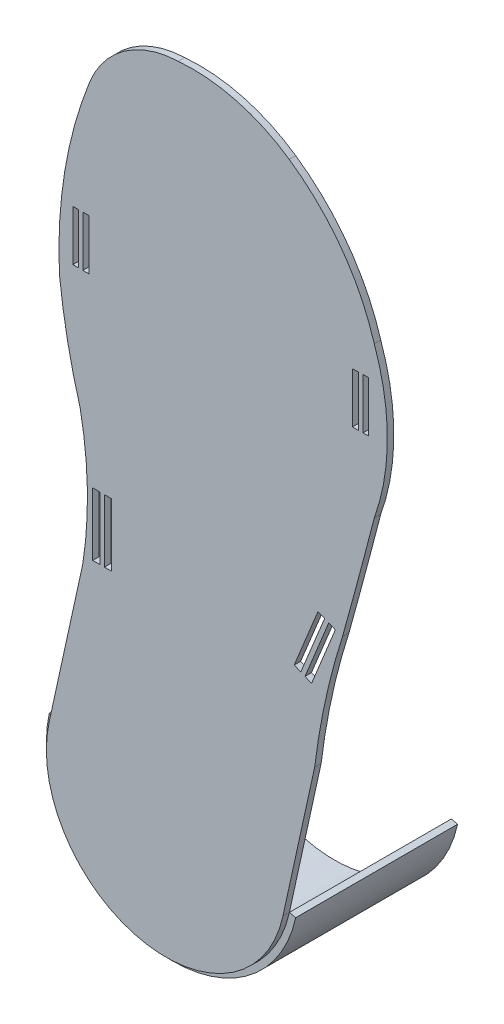
from build123d import *

# Parameters (mm, degrees)
BOSS_EXTRUDE1_DEPTH = 10
BOSS_EXTRUDE2_DEPTH = 250
SKETCH3_W           = 9.565213244
SKETCH3_H           = 77.966410476
SKETCH3_W_2         = 8.353543979
SKETCH3_H_2         = 77.966410475
CUT_EXTRUDE1_DEPTH  = 250
SKETCH4_W           = 11
SKETCH4_H           = 97
CUT_EXTRUDE2_DEPTH  = 250


with BuildPart() as part:
    # Sketch1 → Boss-Extrude1 (new body)
    with BuildSketch(Plane.XY):
        with BuildLine():
            Line((-51.984126252, 392.74957316), (0, 630.098149599))
            ThreePointArc((0, 630.098149599), (7.08288491, 733.363548715), (-3.984096645, 836.278231013))
            ThreePointArc((-3.984096645, 836.278231013), (-23.520457502, 916.694909006), (-36.012597338, 998.502353272))
            ThreePointArc((-36.012597338, 998.502353272), (-27.83897086, 1141.608720593), (10.535208392, 1279.716153066))
            ThreePointArc((10.535208392, 1279.716153066), (64.625002116, 1348.250843062), (147.435292888, 1375.912463775))
            ThreePointArc((147.435292888, 1375.912463775), (237.109169245, 1368.171524242), (318.838797646, 1330.467491469))
            ThreePointArc((318.838797646, 1330.467491469), (399.875156257, 1251.203752857), (450.033178317, 1149.548430819))
            ThreePointArc((450.033178317, 1149.548430819), (470.234397487, 1033.122029824), (450.033178317, 916.695628829))
            ThreePointArc((450.033178317, 916.695628829), (425.902967507, 824.914102712), (400.908098576, 733.364268538))
            ThreePointArc((400.908098576, 733.364268538), (374.881556851, 636.564375255), (358.063754215, 537.74756632))
            Line((358.063754215, 537.74756632), (308.99038073, 313.688874225))
            ThreePointArc((308.99038073, 313.688874225), (88.972777771, 172.731970202), (-51.984126252, 392.74957316))
        make_face()
    extrude(amount=BOSS_EXTRUDE1_DEPTH)

    # Sketch3 → Cut-Extrude1 (cut)
    with BuildSketch(Plane(origin=(0, 0, 0), x_dir=(-1, 0, 0), z_dir=(0, 0, -1))):
        with Locations((-4.782606622, 1061.735695438)):
            Rectangle(SKETCH3_W, SKETCH3_H)
        with Locations((11.17677199, 1061.735695438)):
            Rectangle(SKETCH3_W_2, SKETCH3_H)
        with Locations((-437.019311557, 1060.877248381)):
            Rectangle(SKETCH3_W_2, SKETCH3_H_2)
        with Locations((-421.059932945, 1060.448024852)):
            Rectangle(SKETCH3_W, SKETCH3_H_2)
    extrude(amount=-CUT_EXTRUDE1_DEPTH, mode=Mode.SUBTRACT)

    # Sketch4 → Cut-Extrude2 (cut)
    with BuildSketch(Plane(origin=(0, 0, 0), x_dir=(-1, 0, 0), z_dir=(0, 0, -1))):
        with Locations((-38.83297081, 691.059824561)):
            Rectangle(SKETCH4_W, SKETCH4_H)
        with Locations((-20.83297081, 691.059824561)):
            Rectangle(SKETCH4_W, SKETCH4_H)
        Polygon((-363.124216695, 747.966415693), (-326.394029606, 658.189506878), (-336.574916173, 654.024227929), (-373.305103262, 743.801136745), align=None)
        Polygon((-389.952232486, 736.954664741), (-353.222045397, 647.177755926), (-343.041158831, 651.343034874), (-379.77134592, 741.119943689), align=None)
    extrude(amount=-CUT_EXTRUDE2_DEPTH, mode=Mode.SUBTRACT)


with BuildPart() as body_2:
    # Sketch2 → Boss-Extrude2 (new body)
    with BuildSketch(Plane(origin=(0, 0, 0), x_dir=(-1, 0, 0), z_dir=(0, 0, -1))):
        with BuildLine():
            Line((-318.758829625, 311.549386859), (-308.99038073, 313.688874225))
            ThreePointArc((-308.99038073, 313.688874225), (-88.972777771, 172.731970202), (51.984126252, 392.74957316))
            Line((51.984126252, 392.74957316), (61.752575147, 394.889060526))
            ThreePointArc((61.752575147, 394.889060526), (-86.833290405, 162.963521307), (-318.758829625, 311.549386859))
        make_face()
    extrude(amount=BOSS_EXTRUDE2_DEPTH)


solid = Compound([part.part, body_2.part])
